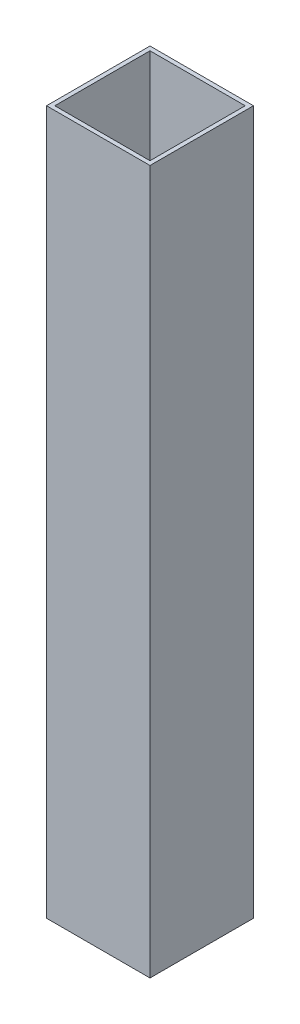
from build123d import *

# Parameters (mm, degrees)
SKETCH1_W           = 50
SKETCH1_H           = 50
SKETCH1_W_2         = 46
SKETCH1_H_2         = 46
BOSS_EXTRUDE1_DEPTH = 340


with BuildPart() as part:
    # Sketch1 → Boss-Extrude1 (new body)
    with BuildSketch(Plane(origin=(0, 0, 0), x_dir=(1, 0, 0), z_dir=(0, 1, 0))):
        Rectangle(SKETCH1_W, SKETCH1_H)
        Rectangle(SKETCH1_W_2, SKETCH1_H_2, mode=Mode.SUBTRACT)
    extrude(amount=BOSS_EXTRUDE1_DEPTH)


solid = part.part
